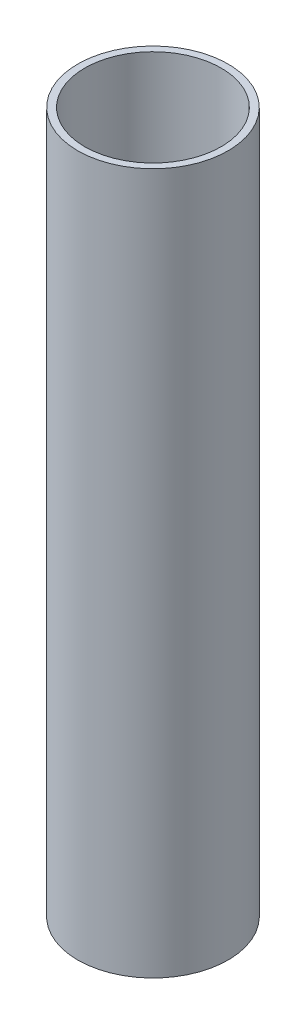
from build123d import *

# Parameters (mm, degrees)
SKETCH1_R           = 0.56
SKETCH1_R_2         = 0.508
BOSS_EXTRUDE1_DEPTH = 5.22


with BuildPart() as part:
    # Sketch1 → Boss-Extrude1 (new body)
    with BuildSketch(Plane(origin=(0, 0, 0), x_dir=(1, 0, 0), z_dir=(0, 1, 0))):
        with Locations(Location((0, 0, 0), (0, 0, 270))):
            Circle(SKETCH1_R)
        with Locations(Location((0, 0, 0), (0, 0, 270))):
            Circle(SKETCH1_R_2, mode=Mode.SUBTRACT)
    extrude(amount=BOSS_EXTRUDE1_DEPTH)


solid = part.part
